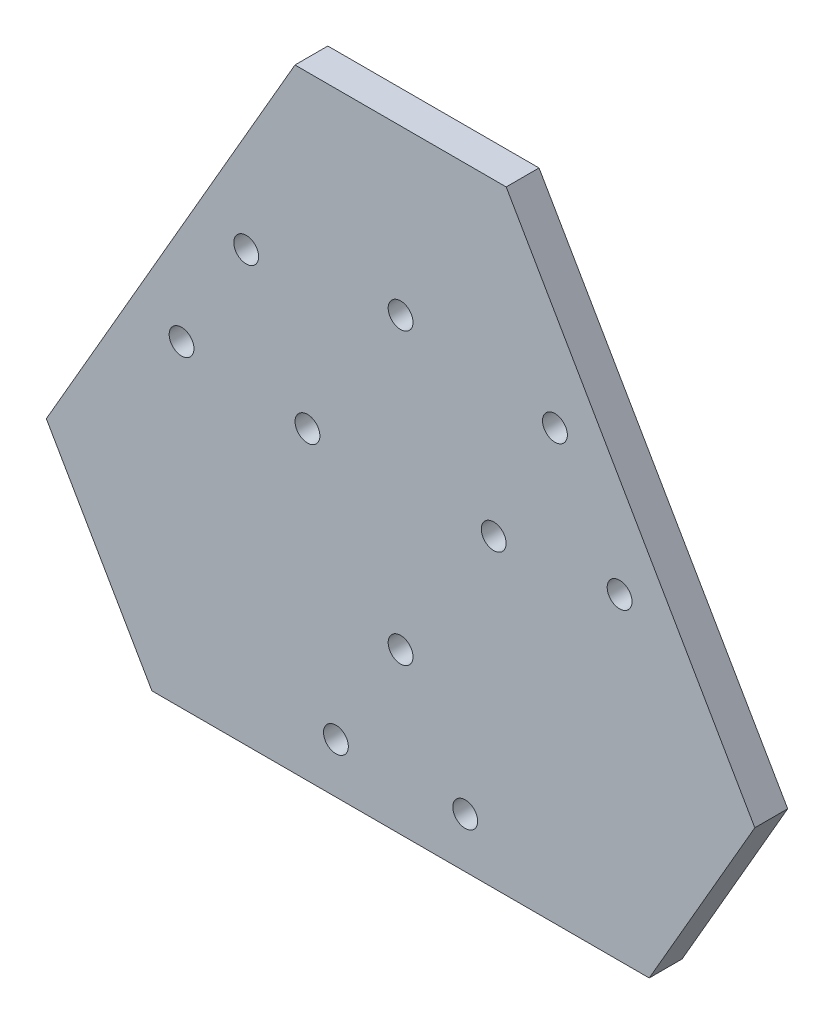
from build123d import *

# Parameters (mm, degrees)
BOSS_EXTRU_1_DEPTH      = 6.35
ENL_V_MAT_EXTRU_1_DEPTH = 136.945378124
D_GAGEMENT_M41_D        = 4.8
D_GAGEMENT_M43_D        = 4.8


with BuildPart() as part:
    # Esquisse1 → Boss.-Extru.1 (new body)
    with BuildSketch(Plane.XY):
        Polygon((-88.9, -51.326438931), (0, 102.652877862), (88.9, -51.326438931), align=None)
    extrude(amount=BOSS_EXTRU_1_DEPTH)

    # Esquisse2 → Enlèv. mat.-Extru.1 (cut, through all)
    with BuildSketch(Plane.XY.offset(6.35)):
        Polygon((-20.415865769, 67.291561069), (20.415865769, 67.291561069), (0, 102.652877862), align=None)
        Polygon((48.068268461, -51.326438931), (88.9, -51.326438931), (68.484134231, -15.965122138), align=None)
        Polygon((-68.484134231, -15.965122138), (-88.9, -51.326438931), (-48.068268461, -51.326438931), align=None)
    extrude(amount=-ENL_V_MAT_EXTRU_1_DEPTH, mode=Mode.SUBTRACT)

    # Dégagement M41 (through all)
    with Locations(Plane.XY.offset(6.35)):
        with Locations((12.5, -41.674438931), (-12.5, -41.674438931), (-42.341122803, 10.011901918), (-29.841122803, 31.662537013), (29.841122803, 31.662537013), (42.341122803, 10.011901918)):
            Hole(D_GAGEMENT_M41_D / 2)

    # Dégagement M43 (through all)
    with Locations(Plane.XY.offset(6.35)):
        with Locations((0, 35.6048), (0, -20.3952), (18, 7.6048), (-18, 7.6048)):
            Hole(D_GAGEMENT_M43_D / 2)


solid = part.part
